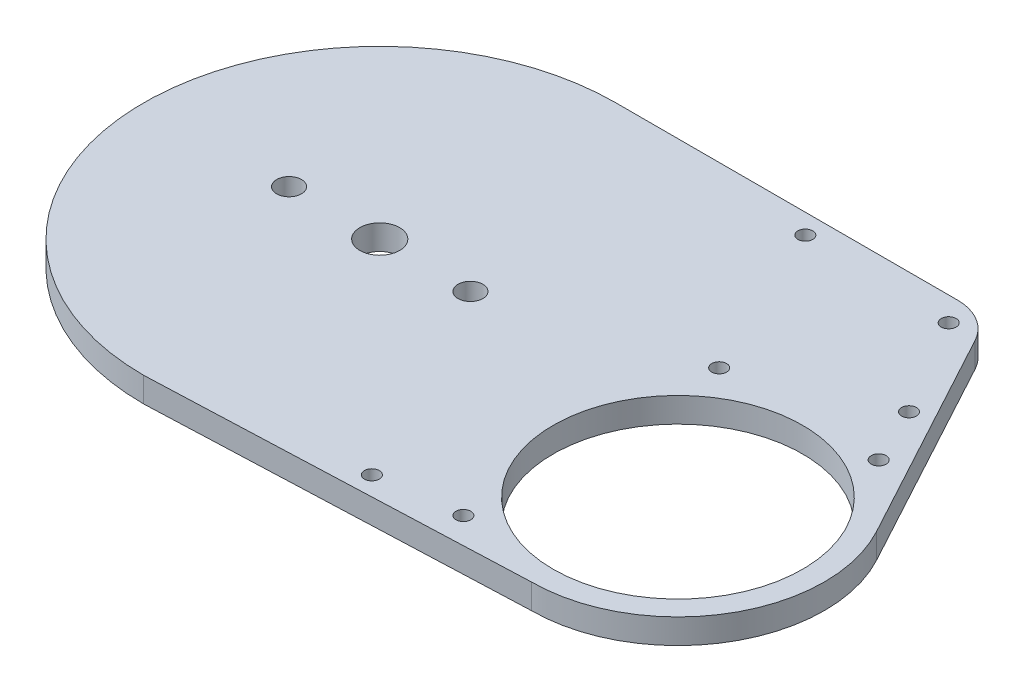
from build123d import *

# Parameters (mm, degrees)
SKETCH1_R           = 25.1
SKETCH1_R_2         = 4
SKETCH1_R_3         = 1.5
SKETCH1_R_4         = 2.5
BOSS_EXTRUDE1_DEPTH = 5


with BuildPart() as part:
    # Sketch1 → Boss-Extrude1 (new body)
    with BuildSketch(Plane(origin=(0, 0, 0), x_dir=(1, 0, 0), z_dir=(0, 1, 0))):
        with BuildLine():
            Line((0, -47.5), (75, -44.5))
            ThreePointArc((75, -44.5), (100.341650726, -30.101348895), (100.945295539, -0.961067014))
            Line((100.945295539, -0.961067014), (77.559049402, 42.258960334))
            ThreePointArc((77.559049402, 42.258960334), (73.883135286, 46.090390077), (68.764033965, 47.5))
            Line((68.764033965, 47.5), (0, 47.5))
            ThreePointArc((0, 47.5), (-47.5, 0), (0, -47.5))
        make_face()
        with Locations(Location((75, -15, 0), (0, 0, 270))):
            Circle(SKETCH1_R, mode=Mode.SUBTRACT)
        with Locations(Location((0, 0, 0), (0, 0, 270))):
            Circle(SKETCH1_R_2, mode=Mode.SUBTRACT)
        with Locations(Location((88.688017257, 11.71100727, 0), (0, 0, 270))):
            Circle(SKETCH1_R_3, mode=Mode.SUBTRACT)
        with Locations(Location((56.591696316, 11.71100727, 0), (0, 0, 270))):
            Circle(SKETCH1_R_3, mode=Mode.SUBTRACT)
        with Locations(Location((56.591696316, -39.768646015, 0), (0, 0, 270))):
            Circle(SKETCH1_R_3, mode=Mode.SUBTRACT)
        with Locations(Location((18.25, 0, 0), (0, 0, 270))):
            Circle(SKETCH1_R_4, mode=Mode.SUBTRACT)
        with Locations(Location((-18.25, 0, 0), (0, 0, 270))):
            Circle(SKETCH1_R_4, mode=Mode.SUBTRACT)
        with Locations(Location((71.835494757, 42.654234046, 0), (0, 0, 270))):
            Circle(SKETCH1_R_3, mode=Mode.SUBTRACT)
        with Locations(Location((42.137334928, 43.5, 0), (0, 0, 270))):
            Circle(SKETCH1_R_3, mode=Mode.SUBTRACT)
        with Locations(Location((83.354686129, 23.142870245, 0), (0, 0, 270))):
            Circle(SKETCH1_R_3, mode=Mode.SUBTRACT)
        with Locations(Location((40.293422434, -41.885064382, 0), (0, 0, 270))):
            Circle(SKETCH1_R_3, mode=Mode.SUBTRACT)
    extrude(amount=BOSS_EXTRUDE1_DEPTH)


solid = part.part
